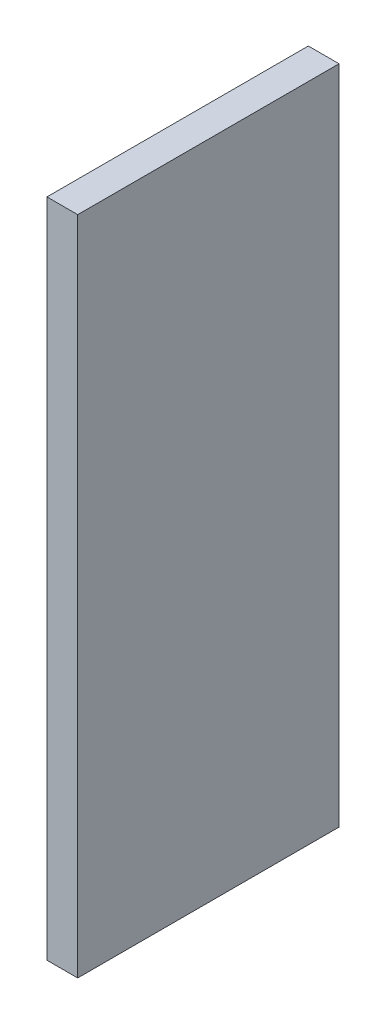
from build123d import *

# Parameters (mm, degrees)
SKETCH1_W           = 215
SKETCH1_H           = 85
BOSS_EXTRUDE1_DEPTH = 5


with BuildPart() as part:
    # Sketch1 → Boss-Extrude1 (new, symmetric)
    with BuildSketch(Plane.YZ):
        Rectangle(SKETCH1_W, SKETCH1_H)
    extrude(amount=BOSS_EXTRUDE1_DEPTH, both=True)


solid = part.part
